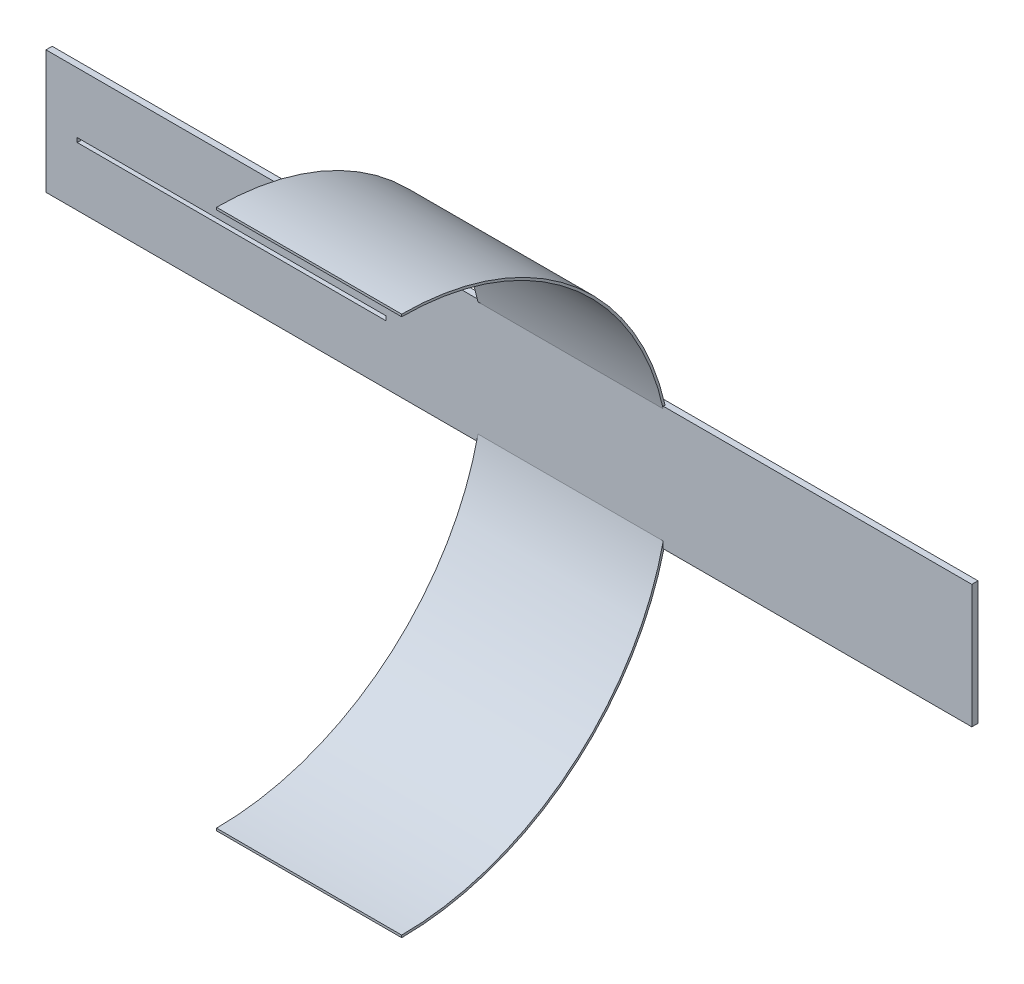
from build123d import *

# Parameters (mm, degrees)
SZKIC4_W                    = 150
SZKIC4_H                    = 20
SZKIC4_W_2                  = 50
SZKIC4_H_2                  = 0.7
DODANIE_WYCI_GNI_CIE1_DEPTH = 1
DODANIE_WYCI_GNI_CIE2_DEPTH = 30


with BuildPart() as part:
    # Szkic4 → Dodanie-wyciągnięcie1 (new body)
    with BuildSketch(Plane.XY):
        with Locations((44.938160122, 0.128489408)):
            Rectangle(SZKIC4_W, SZKIC4_H)
        Rectangle(SZKIC4_W_2, SZKIC4_H_2, mode=Mode.SUBTRACT)
    extrude(amount=DODANIE_WYCI_GNI_CIE1_DEPTH)

    # Szkic8 → Dodanie-wyciągnięcie2 (add)
    with BuildSketch(Plane(origin=(69.938160122, 0, 0), x_dir=(0, 0, -1), z_dir=(1, 0, 0))):
        with BuildLine():
            ThreePointArc((0.375817697, 0.480392187), (-12.438260626, 31.416313864), (-43.374182303, 44.230392187))
            Line((-43.374182303, 44.230392187), (-43.374182303, 43.857234708))
            ThreePointArc((-43.374182303, 43.857234708), (-12.70212281, 31.15245168), (0.002660218, 0.480392187))
            ThreePointArc((0.002660218, 0.480392187), (-12.70212281, -30.191667306), (-43.374182303, -42.896450334))
            Line((-43.374182303, -42.896450334), (-43.374182303, -43.269607813))
            ThreePointArc((-43.374182303, -43.269607813), (-12.438260626, -30.45552949), (0.375817697, 0.480392187))
        make_face()
    extrude(amount=-DODANIE_WYCI_GNI_CIE2_DEPTH)


solid = part.part
